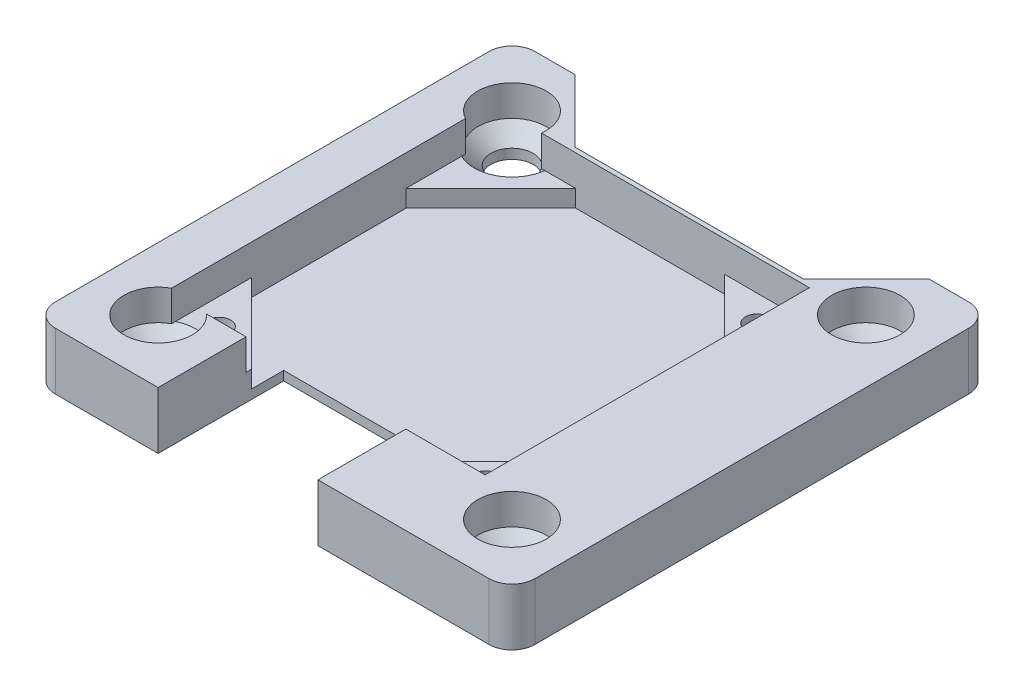
from build123d import *

# Parameters (mm, degrees)
SKETCH_1_W               = 42
SKETCH_1_H               = 42
SKETCH_1_R               = 1.85
EXTRUDE_1_DEPTH          = 5
FILLET_2_R               = 2
FILLET_3_R               = 2
FILLET_4_R               = 2
FILLET_5_R               = 2
CUT_EXTRUDE_3_DEPTH      = 31.116440693
SKETCH_6_W               = 14
SKETCH_6_H               = 11
CUT_EXTRUDE_4_DEPTH      = 31.116440693
SKETCH_8_R               = 1
CUT_EXTRUDE_6_DEPTH      = 31.116440693
SKETCH_9_R               = 3
CUT_EXTRUDE_7_DEPTH      = 2.7
SKETCH_11_W              = 27.9
SKETCH_11_H              = 28.4
CUT_EXTRUDE_14_DEPTH     = 2.7
CUT_EXTRUDE_15_DEPTH     = 1.5
HOLE_WIZARD_1_AT_2_COUNT = 2
HOLE_WIZARD_1_AT_2_PITCH = 31
HOLE_WIZARD_1_AT_3_COUNT = 2
HOLE_WIZARD_1_AT_3_PITCH = 43.840620434
HOLE_WIZARD_1_AT_4_COUNT = 2
HOLE_WIZARD_1_AT_4_PITCH = 31


with BuildPart() as part:
    # 草图1 → 凸台-拉伸1 (new body)
    with BuildSketch(Plane(origin=(0, 0, 0), x_dir=(1, 0, 0), z_dir=(0, 1, 0))):
        Rectangle(SKETCH_1_W, SKETCH_1_H)
        with Locations(Location((15.5, 15.5, 0), (0, 0, 270))):
            Circle(SKETCH_1_R, mode=Mode.SUBTRACT)
        with Locations(Location((-15.5, 15.5, 0), (0, 0, 270))):
            Circle(SKETCH_1_R, mode=Mode.SUBTRACT)
        with Locations(Location((-15.5, -15.5, 0), (0, 0, 270))):
            Circle(SKETCH_1_R, mode=Mode.SUBTRACT)
        with Locations(Location((15.5, -15.5, 0), (0, 0, 270))):
            Circle(SKETCH_1_R, mode=Mode.SUBTRACT)
    extrude(amount=EXTRUDE_1_DEPTH)

    # 圆角2
    fillet_2_edges = [part.edges().sort_by_distance(p)[0] for p in [
        (-21, 2.5, -21),
    ]]
    fillet(fillet_2_edges, radius=FILLET_2_R)

    # 圆角3
    fillet_3_edges = [part.edges().sort_by_distance(p)[0] for p in [
        (-21, 2.5, 21),
    ]]
    fillet(fillet_3_edges, radius=FILLET_3_R)

    # 圆角4
    fillet_4_edges = [part.edges().sort_by_distance(p)[0] for p in [
        (21, 2.5, 21),
    ]]
    fillet(fillet_4_edges, radius=FILLET_4_R)

    # 圆角5
    fillet_5_edges = [part.edges().sort_by_distance(p)[0] for p in [
        (21, 2.5, -21),
    ]]
    fillet(fillet_5_edges, radius=FILLET_5_R)

    # 草图5 → 切除-拉伸3 (cut, through all)
    with BuildSketch(Plane.XZ):
        Polygon((-15.5, -21), (-10, -15.5), (10, -15.5), (15.5, -21), align=None)
    extrude(amount=-CUT_EXTRUDE_3_DEPTH, mode=Mode.SUBTRACT)

    # 草图6 → 切除-拉伸4 (cut, through all)
    with BuildSketch(Plane.XZ):
        with Locations((-3, 15.5)):
            Rectangle(SKETCH_6_W, SKETCH_6_H)
    extrude(amount=-CUT_EXTRUDE_4_DEPTH, mode=Mode.SUBTRACT)

    # 草图8 → 切除-拉伸6 (cut, through all)
    with BuildSketch(Plane(origin=(0, 5, 0), x_dir=(1, 0, 0), z_dir=(0, 1, 0))):
        with Locations(Location((-14.65, -11, 0), (0, 0, 270))):
            Circle(SKETCH_8_R)
        with Locations(Location((8.65, -11, 0), (0, 0, 270))):
            Circle(SKETCH_8_R)
        with Locations(Location((8.65, 12.8, 0), (0, 0, 270))):
            Circle(SKETCH_8_R)
    extrude(amount=-CUT_EXTRUDE_6_DEPTH, mode=Mode.SUBTRACT)

    # 草图9 → 切除-拉伸7 (cut)
    with BuildSketch(Plane(origin=(0, 5, 0), x_dir=(1, 0, 0), z_dir=(0, 1, 0))):
        with Locations(Location((-15.5, 15.5, 0), (0, 0, 270))):
            Circle(SKETCH_9_R)
        with Locations(Location((15.5, 15.5, 0), (0, 0, 270))):
            Circle(SKETCH_9_R)
        with Locations(Location((15.5, -15.5, 0), (0, 0, 270))):
            Circle(SKETCH_9_R)
        with Locations(Location((-15.5, -15.5, 0), (0, 0, 270))):
            Circle(SKETCH_9_R)
    extrude(amount=-CUT_EXTRUDE_7_DEPTH, mode=Mode.SUBTRACT)

    # 草图11 → 切除-拉伸14 (cut)
    with BuildSketch(Plane(origin=(0, 5, 0), x_dir=(1, 0, 0), z_dir=(0, 1, 0))):
        with Locations((-3, 0.9)):
            Rectangle(SKETCH_11_W, SKETCH_11_H)
    extrude(amount=-CUT_EXTRUDE_14_DEPTH, mode=Mode.SUBTRACT)

    # 草图12 → 切除-拉伸15 (cut)
    with BuildSketch(Plane(origin=(0, 2.3, 0), x_dir=(1, 0, 0), z_dir=(0, 1, 0))):
        Polygon((10.95, -5.871572875), (10.95, 7.671572875), (3.521572875, 15.1), (-9.521572875, 15.1), (-16.95, 7.671572875), (-16.95, -5.871572875), (-9.521572875, -13.3), (3.521572875, -13.3), align=None)
    extrude(amount=-CUT_EXTRUDE_15_DEPTH, mode=Mode.SUBTRACT)

    # 草图14 → 打孔尺寸(%根据十字)槽半沉头木螺钉的类型1 (revolve, cut)
    with BuildSketch(Plane(origin=(15.5, 2.3, 15.5), x_dir=(0, 0, 1), z_dir=(1, 0, 0))):
        Polygon((0, 0), (0, 2.3), (1.8, 2.3), (1.8, 1.5), (3.3, 0), align=None)
    hole_wizard_1 = revolve(axis=Axis((15.5, 8.65, 15.5), (0, -1, 0)), mode=Mode.SUBTRACT)

    # 打孔尺寸(%根据十字)槽半沉头木螺钉的类型1 at 2: 打孔尺寸(%根据十字)槽半沉头木螺钉的类型1 ×2
    with Locations(*[(-i * HOLE_WIZARD_1_AT_2_PITCH, 0, 0) for i in range(1, HOLE_WIZARD_1_AT_2_COUNT)]):
        add(hole_wizard_1, mode=Mode.SUBTRACT)

    # 打孔尺寸(%根据十字)槽半沉头木螺钉的类型1 at 3: 打孔尺寸(%根据十字)槽半沉头木螺钉的类型1 ×2
    with Locations(*[Vector(-0.7071067811865476, 0, -0.7071067811865476) * (i * HOLE_WIZARD_1_AT_3_PITCH) for i in range(1, HOLE_WIZARD_1_AT_3_COUNT)]):
        add(hole_wizard_1, mode=Mode.SUBTRACT)

    # 打孔尺寸(%根据十字)槽半沉头木螺钉的类型1 at 4: 打孔尺寸(%根据十字)槽半沉头木螺钉的类型1 ×2
    with Locations(*[(0, 0, -i * HOLE_WIZARD_1_AT_4_PITCH) for i in range(1, HOLE_WIZARD_1_AT_4_COUNT)]):
        add(hole_wizard_1, mode=Mode.SUBTRACT)


solid = part.part
